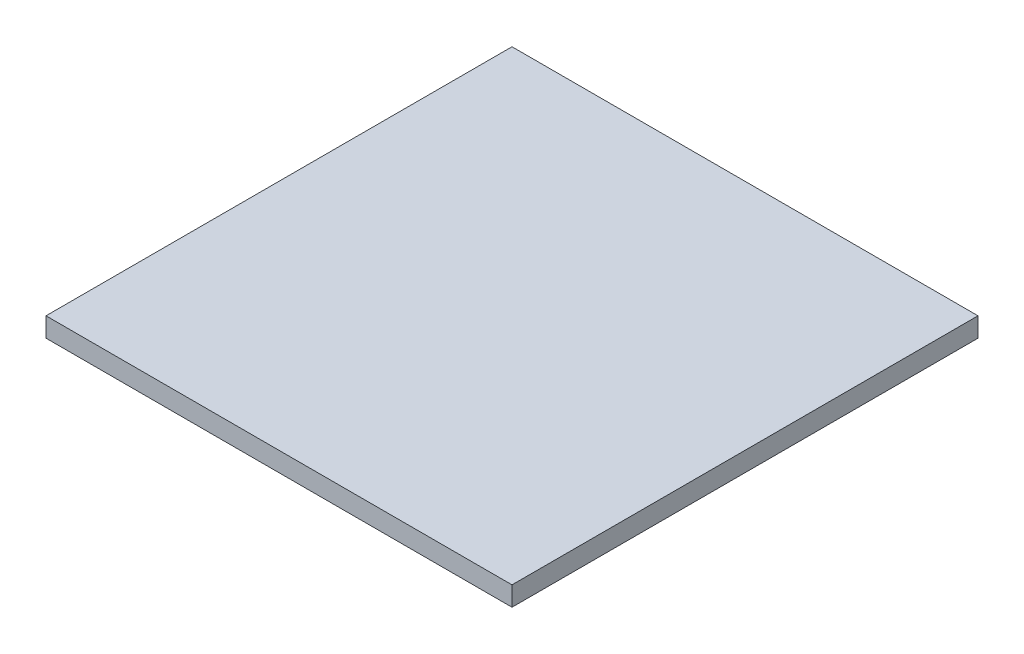
from build123d import *

# Parameters (mm, degrees)
SZKIC1_W                    = 12
SZKIC1_H                    = 12
DODANIE_WYCI_GNI_CIE1_DEPTH = 0.5


with BuildPart() as part:
    # Szkic1 → Dodanie-wyciągnięcie1 (new body)
    with BuildSketch(Plane(origin=(0, 0, 0), x_dir=(1, 0, 0), z_dir=(0, 1, 0))):
        Rectangle(SZKIC1_W, SZKIC1_H)
    extrude(amount=DODANIE_WYCI_GNI_CIE1_DEPTH)


solid = part.part
